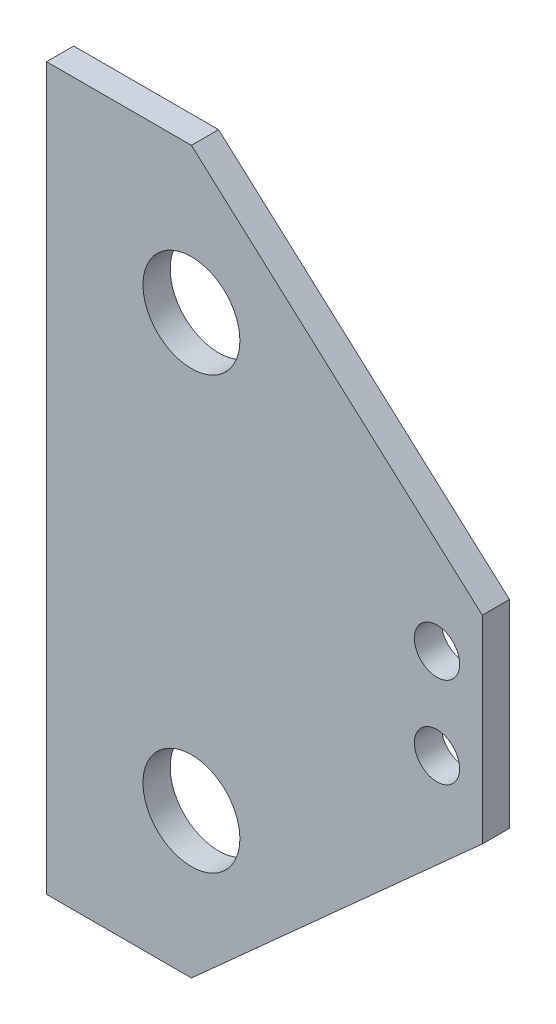
from build123d import *

# Parameters (mm, degrees)
SKETCH1_R           = 5.35
SKETCH1_R_2         = 2.5
BOSS_EXTRUDE1_DEPTH = 3


with BuildPart() as part:
    # Sketch1 → Boss-Extrude1 (new body)
    with BuildSketch(Plane.XY):
        Polygon((17.607305335, 36.623383418), (1.607305335, 36.623383418), (1.607305335, -43.006616582), (17.607305335, -43.006616582), (49.72430499, -14.134378509), (49.72430499, 7.751145345), align=None)
        with Locations((17.607305335, -27.006616582)):
            Circle(SKETCH1_R, mode=Mode.SUBTRACT)
        with Locations((44.72430499, -8.191616582)):
            Circle(SKETCH1_R_2, mode=Mode.SUBTRACT)
        with Locations((44.72430499, 1.808383418)):
            Circle(SKETCH1_R_2, mode=Mode.SUBTRACT)
        with Locations((17.607305335, 20.623383418)):
            Circle(SKETCH1_R, mode=Mode.SUBTRACT)
    extrude(amount=BOSS_EXTRUDE1_DEPTH)


solid = part.part
